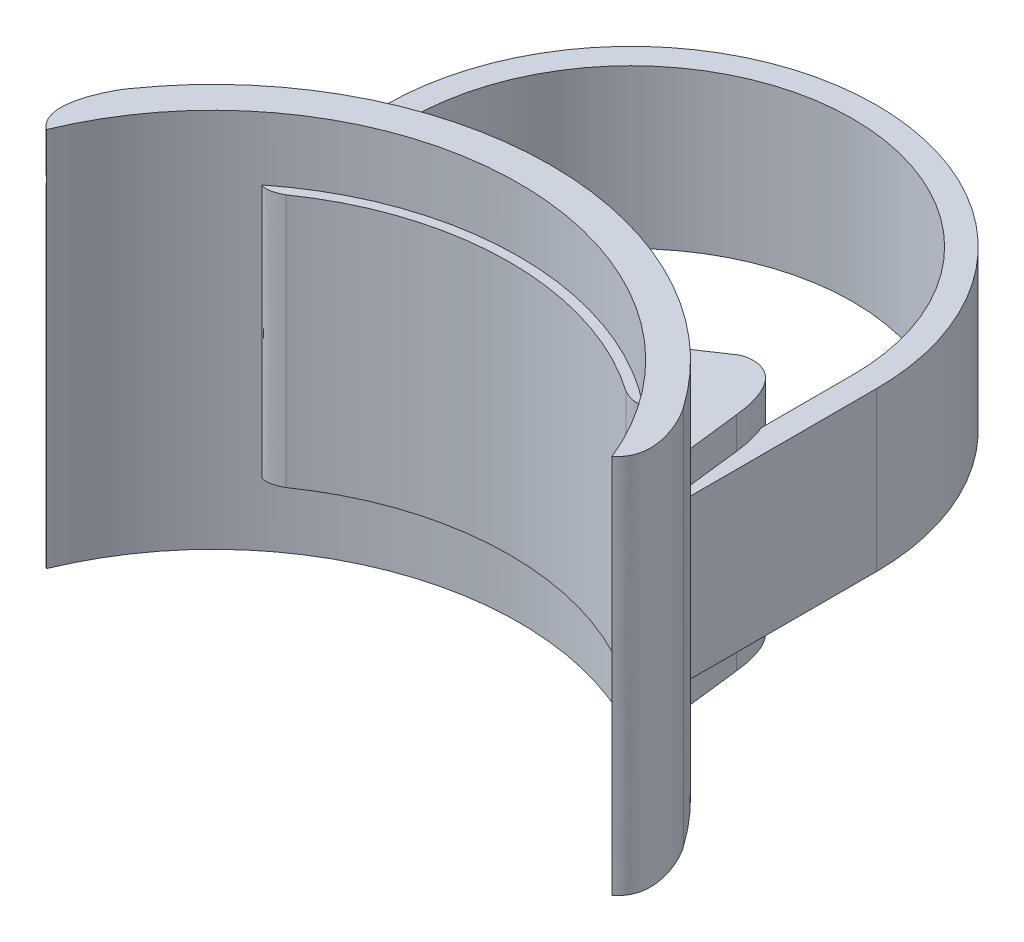
from build123d import *

# Parameters (mm, degrees)
BOSS_EXTRUDE1_DEPTH = 6
BOSS_EXTRUDE2_DEPTH = 2.5
BOSS_EXTRUDE3_DEPTH = 3.5
BOSS_EXTRUDE4_DEPTH = 4


with BuildPart() as part:
    # Sketch1 → Boss-Extrude1 (new, symmetric)
    with BuildSketch(Plane(origin=(0, 0, 0), x_dir=(1, 0, 0), z_dir=(0, 1, 0))):
        with BuildLine():
            ThreePointArc((8.92789337, 3.662679343), (0, 9.65), (-8.92789337, 3.662679343))
            add(Edge.make_bspline(
                [(-8.724914389, 6.107239058), (-8.904858788, 5.893861034), (-9.803458989, 4.322571827), (-8.92789337, 3.662679343)],
                knots=[0, 0, 0, 0, 1, 1, 1, 1], degree=3))
            ThreePointArc((-8.724914389, 6.107239058), (0, 10.65), (8.724914389, 6.107239058))
            add(Edge.make_bspline(
                [(8.724914389, 6.107239058), (8.904858788, 5.893861034), (9.803458989, 4.322571827), (8.92789337, 3.662679343)],
                knots=[0, 0, 0, 0, 1, 1, 1, 1], degree=3))
        make_face()
    extrude(amount=BOSS_EXTRUDE1_DEPTH, both=True)

    # Sketch2 → Boss-Extrude2 (add, symmetric)
    with BuildSketch(Plane(origin=(0, 0, 0), x_dir=(1, 0, 0), z_dir=(0, 1, 0))):
        with BuildLine():
            Line((-7.75, 13.180055627), (-7.75, 6.976773921))
            Line((-7.75, 6.976773921), (-7, 6.976773921))
            Line((-7, 6.976773921), (-7, 13.180055627))
            ThreePointArc((-7, 13.180055627), (0, 20.180055627), (7, 13.180055627))
            Line((7, 13.180055627), (7, 6.976773921))
            Line((7, 6.976773921), (7.75, 6.976773921))
            Line((7.75, 6.976773921), (7.75, 13.180055627))
            ThreePointArc((7.75, 13.180055627), (0, 20.930055627), (-7.75, 13.180055627))
        make_face()
    extrude(amount=BOSS_EXTRUDE2_DEPTH, both=True)

    # Sketch3 → Boss-Extrude3 (add, symmetric)
    with BuildSketch(Plane(origin=(0, 0, 0), x_dir=(1, 0, 0), z_dir=(0, 1, 0))):
        with BuildLine():
            add(Edge.make_bspline(
                [(-7.25611922, 9.254992682), (-7.041583851, 11.20624294), (-5.98153876, 11.097373504), (-5.637887905, 10.914088424)],
                knots=[0, 0, 0, 0, 1, 1, 1, 1], degree=3))
            Line((-5.637887905, 10.914088424), (-4.051396134, 9.849298928))
            ThreePointArc((-4.051396134, 9.849298928), (-5.858619381, 8.893766297), (-7.449979396, 7.610539205))
            Line((-7.449979396, 7.610539205), (-7.25611922, 9.254992682))
        make_face()
        with BuildLine():
            Line((7.449979396, 7.610539205), (7.25611922, 9.254992682))
            add(Edge.make_bspline(
                [(7.25611922, 9.254992682), (7.041583851, 11.20624294), (5.98153876, 11.097373504), (5.637887905, 10.914088424)],
                knots=[0, 0, 0, 0, 1, 1, 1, 1], degree=3))
            Line((5.637887905, 10.914088424), (4.051396134, 9.849298928))
            ThreePointArc((4.051396134, 9.849298928), (5.858619381, 8.893766297), (7.449979396, 7.610539205))
        make_face()
    extrude(amount=BOSS_EXTRUDE3_DEPTH, both=True)

    # Sketch4 → Boss-Extrude4 (add, symmetric)
    with BuildSketch(Plane(origin=(0, 0, 0), x_dir=(1, 0, 0), z_dir=(0, 1, 0))):
        with BuildLine():
            ThreePointArc((6.013295106, 7.547369208), (0, 9.65), (-6.013295106, 7.547369208))
            add(Edge.make_bspline(
                [(-5.359344629, 7.661587639), (-5.783257591, 7.437743582), (-6.013295106, 7.547369208)],
                knots=[0, 0, 0, 1, 1, 1], degree=2))
            ThreePointArc((-5.359344629, 7.661587639), (0, 9.35), (5.359344629, 7.661587639))
            add(Edge.make_bspline(
                [(5.359344629, 7.661587639), (5.783257591, 7.437743582), (6.013295106, 7.547369208)],
                knots=[0, 0, 0, 1, 1, 1], degree=2))
        make_face()
    extrude(amount=BOSS_EXTRUDE4_DEPTH, both=True)


solid = part.part
